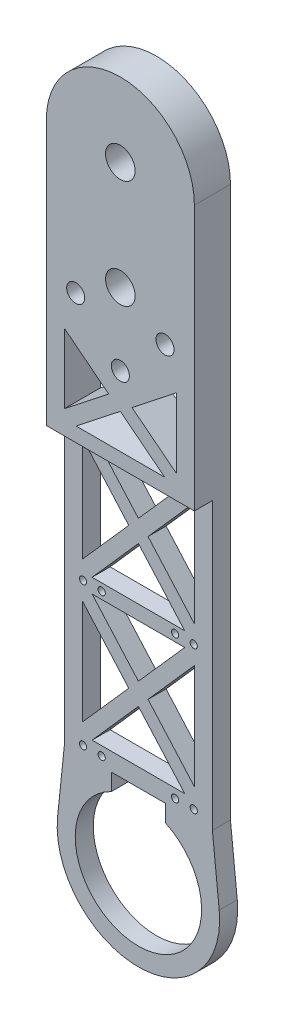
from build123d import *

# Parameters (mm, degrees)
SKETCH_1_R               = 20.5
SKETCH_1_R_2             = 6.5
SKETCH_1_R_3             = 1.5
EXTRUDE_1_DEPTH          = 10
SKETCH_2_R               = 4.1
CUT_EXTRUDE_1_DEPTH      = 10
SKETCH_4_W               = 41
SKETCH_4_H               = 120.125
CUT_EXTRUDE_3_DEPTH      = 5
CUT_EXTRUDE_4_DEPTH      = 195.839677684
CUT_EXTRUDE_4_DEPTH_BACK = 10
CUT_EXTRUDE_5_DEPTH      = 195.839677684
CUT_EXTRUDE_5_DEPTH_BACK = 10
SKETCH_5_W               = 41
SKETCH_5_H               = 41
CUT_EXTRUDE_6_DEPTH      = 10
EXTRUDE_START            = -5
EXTRUDE_2_DEPTH          = 5
SKETCH_7_R               = 1
CUT_EXTRUDE_7_DEPTH      = 195.867903976
SKETCH_8_R               = 2.5
CUT_EXTRUDE_8_DEPTH      = 10
CUT_EXTRUDE_START        = -10
SKETCH_9_R               = 5
CUT_EXTRUDE_9_DEPTH      = 1.8
FILLET_1_R               = 0.2


with BuildPart() as part:
    # 스케치1 → 보스-돌출1 (new body)
    # profile 1 of 3: a face of its own
    with BuildSketch(Plane.XY):
        with BuildLine():
            Line((-20.5, 173), (-20.5, 0))
            ThreePointArc((-20.5, 0), (0, 20.5), (20.5, 0))
            Line((20.5, 0), (20.5, 173))
            ThreePointArc((20.5, 173), (0, 152.5), (-20.5, 173))
        make_face()
    # profile 2 of 3: a face of its own
    with BuildSketch(Plane.XY):
        with Locations((0, 173)):
            Circle(SKETCH_1_R)
    # profile 3 of 3: a face of its own
    with BuildSketch(Plane.XY):
        Circle(SKETCH_1_R)
        with Locations((0, -7)):
            Circle(SKETCH_1_R_2, mode=Mode.SUBTRACT)
        with Locations((-7.75, -13.423393759)):
            Circle(SKETCH_1_R_3, mode=Mode.SUBTRACT)
        with Locations((7.75, -13.423393759)):
            Circle(SKETCH_1_R_3, mode=Mode.SUBTRACT)
        with Locations((15.5, 0)):
            Circle(SKETCH_1_R_3, mode=Mode.SUBTRACT)
        with Locations((7.75, 13.423393759)):
            Circle(SKETCH_1_R_3, mode=Mode.SUBTRACT)
        with Locations((-7.75, 13.423393759)):
            Circle(SKETCH_1_R_3, mode=Mode.SUBTRACT)
        with Locations((-15.5, 0)):
            Circle(SKETCH_1_R_3, mode=Mode.SUBTRACT)
    extrude(amount=-EXTRUDE_1_DEPTH)

    # 스케치2 → 컷-돌출1 (cut)
    with BuildSketch(Plane.XY):
        with Locations((0, 173)):
            Circle(SKETCH_2_R)
        with Locations((0, 143)):
            Circle(SKETCH_2_R)
    extrude(amount=-CUT_EXTRUDE_1_DEPTH, mode=Mode.SUBTRACT)

    # 스케치4 → 컷-돌출3 (cut)
    with BuildSketch(Plane.XY):
        with Locations((0, 39.5625)):
            Rectangle(SKETCH_4_W, SKETCH_4_H)
    extrude(amount=-CUT_EXTRUDE_3_DEPTH, mode=Mode.SUBTRACT)

    # 스케치3 → 컷-돌출4 (cut, two sides: drawn at the far end of the back side and taken through both)
    with BuildSketch(Plane.XY.offset(-CUT_EXTRUDE_4_DEPTH_BACK)):
        Polygon((15.5, 125.455788946), (3.235714571, 115.8125), (15.5, 106.169211054), align=None)
        Polygon((12.264285429, 103.625), (0, 113.268288946), (-12.264285429, 103.625), align=None)
        Polygon((-3.235714571, 115.8125), (-15.5, 125.455788946), (-15.5, 106.169211054), align=None)
    extrude(amount=CUT_EXTRUDE_4_DEPTH + CUT_EXTRUDE_4_DEPTH_BACK, mode=Mode.SUBTRACT)

    # 스케치3<4> → 컷-돌출5 (cut, two sides: drawn at the far end of the back side and taken through both)
    with BuildSketch(Plane.XY.offset(-CUT_EXTRUDE_5_DEPTH_BACK)):
        Polygon((12.830480138, 99.625), (-12.830480138, 99.625), (0, 85.112071418), align=None)
        Polygon((15.5, 67.579571418), (15.5, 96.605428582), (2.669519862, 82.0925), align=None)
        Polygon((12.830480138, 64.56), (0, 79.072928582), (-12.830480138, 64.56), align=None)
        Polygon((-2.669519862, 82.0925), (-15.5, 96.605428582), (-15.5, 67.579571418), align=None)
        Polygon((12.830313114, 60.56), (-12.830313114, 60.56), (0, 46.049329749), align=None)
        Polygon((-2.669686886, 43.03), (-15.5, 57.540670251), (-15.5, 28.519329749), align=None)
        Polygon((12.830313114, 25.5), (0, 40.010670251), (-12.830313114, 25.5), align=None)
        Polygon((15.5, 28.519329749), (15.5, 57.540670251), (2.669686886, 43.03), align=None)
    extrude(amount=CUT_EXTRUDE_5_DEPTH + CUT_EXTRUDE_5_DEPTH_BACK, mode=Mode.SUBTRACT)

    # 스케치5 → 컷-돌출6 (cut)
    with BuildSketch(Plane.XY):
        Rectangle(SKETCH_5_W, SKETCH_5_H)
    extrude(amount=-CUT_EXTRUDE_6_DEPTH, mode=Mode.SUBTRACT)

    # 스케치6 → 보스-돌출2 (add)
    with BuildSketch(Plane.XY.offset(EXTRUDE_START)):
        with BuildLine():
            ThreePointArc((-22.380643152, 2.314478799), (-18.253119335, 13.155745306), (-9.273618495, 20.5))
            Line((-9.273618495, 20.5), (-20.5, 20.5))
            Line((-20.5, 20.5), (-22.380643152, 2.314478799))
        make_face()
        with BuildLine():
            Line((-7.5, 15.811388301), (-7.5, 20.5))
            Line((-7.5, 20.5), (-9.273618495, 20.5))
            ThreePointArc((-9.273618495, 20.5), (-18.253119335, 13.155745306), (-22.380643152, 2.314478799))
            ThreePointArc((-22.380643152, 2.314478799), (-1.158777176, -22.470140975), (22.5, 0))
            ThreePointArc((22.5, 0), (22.470140975, 1.158777176), (22.380643152, 2.314478799))
            ThreePointArc((22.380643152, 2.314478799), (18.253119335, 13.155745306), (9.273618495, 20.5))
            Line((9.273618495, 20.5), (7.5, 20.5))
            Line((7.5, 20.5), (7.5, 15.811388301))
            ThreePointArc((7.5, 15.811388301), (14.790199458, 9.354143467), (17.5, 0))
            ThreePointArc((17.5, 0), (-9.354143467, -14.790199458), (-7.5, 15.811388301))
        make_face()
        with BuildLine():
            Line((20.5, 20.5), (9.273618495, 20.5))
            ThreePointArc((9.273618495, 20.5), (18.253119335, 13.155745306), (22.380643152, 2.314478799))
            Line((22.380643152, 2.314478799), (20.5, 20.5))
        make_face()
    extrude(amount=-EXTRUDE_2_DEPTH)

    # 스케치7 → 컷-돌출7 (cut, through all)
    with BuildSketch(Plane.XY.offset(-5)):
        with Locations((-15.33, 23)):
            Circle(SKETCH_7_R)
        with Locations((-10.16, 23)):
            Circle(SKETCH_7_R)
        with Locations((10.16, 23)):
            Circle(SKETCH_7_R)
        with Locations((15.33, 23)):
            Circle(SKETCH_7_R)
        with Locations((-15.33, 62.56)):
            Circle(SKETCH_7_R)
        with Locations((-10.16, 62.56)):
            Circle(SKETCH_7_R)
        with Locations((10.16, 62.56)):
            Circle(SKETCH_7_R)
        with Locations((15.33, 62.56)):
            Circle(SKETCH_7_R)
    extrude(amount=-CUT_EXTRUDE_7_DEPTH, mode=Mode.SUBTRACT)

    # 스케치8 → 컷-돌출8 (cut)
    with BuildSketch(Plane.XY):
        with Locations((-12.37, 135.5)):
            Circle(SKETCH_8_R)
        with Locations((0, 123)):
            Circle(SKETCH_8_R)
        with Locations((12.37, 135.5)):
            Circle(SKETCH_8_R)
    extrude(amount=-CUT_EXTRUDE_8_DEPTH, mode=Mode.SUBTRACT)

    # 스케치9 → 컷-돌출9 (cut)
    with BuildSketch(Plane.XY.offset(CUT_EXTRUDE_START)):
        with Locations((0, 173)):
            Circle(SKETCH_9_R)
        with Locations((0, 143)):
            Circle(SKETCH_9_R)
    extrude(amount=CUT_EXTRUDE_9_DEPTH, mode=Mode.SUBTRACT)

    # 필렛1
    fillet_1_edges = [part.edges().sort_by_distance(p)[0] for p in [
        (-4.1, 173, -8.2),
        (-5, 173, -10),
        (-4.1, 143, -8.2),
        (-5, 143, -10),
    ]]
    fillet(fillet_1_edges, radius=FILLET_1_R)


solid = part.part
